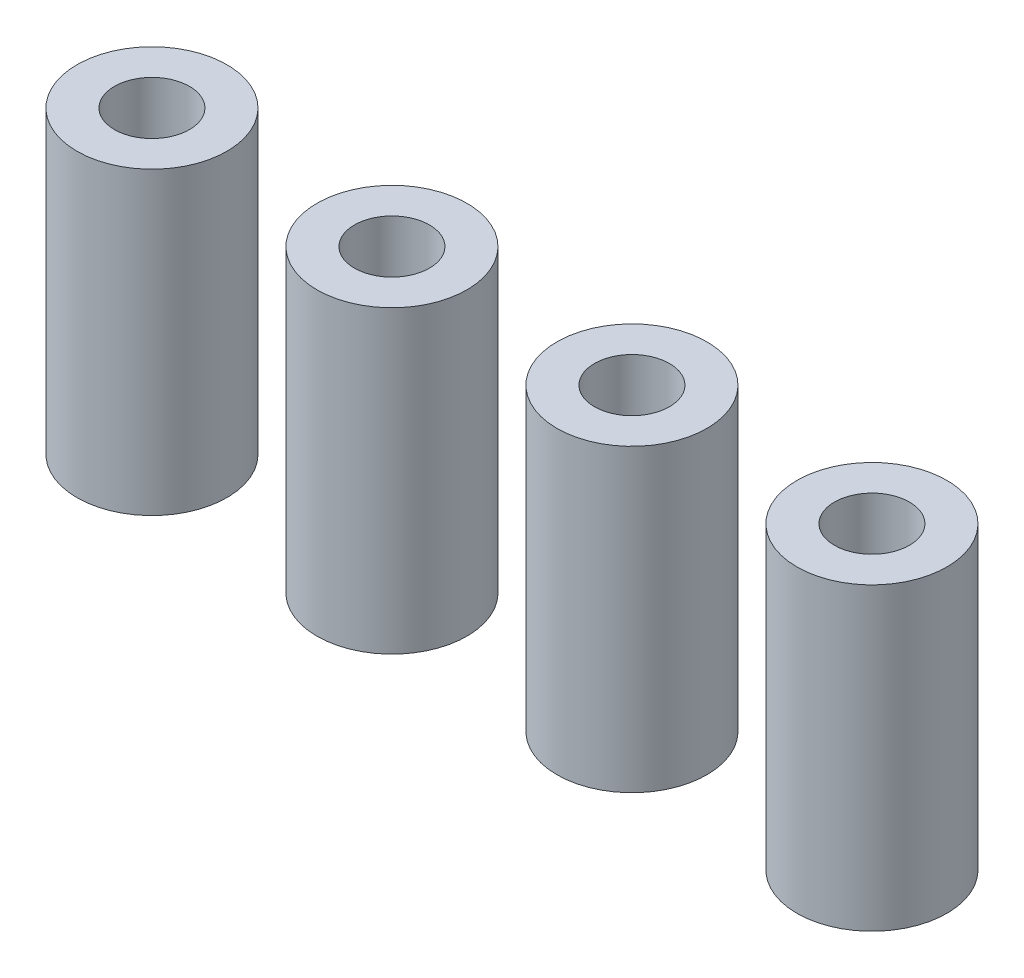
from build123d import *

# Parameters (mm, degrees)
SKETCH1_R             = 2.5
SKETCH1_R_2           = 1.25
BOSS_EXTRUDE1_DEPTH   = 10
BOSS_EXTRUDE1_2_DEPTH = 10
BOSS_EXTRUDE1_3_DEPTH = 10
BOSS_EXTRUDE1_4_DEPTH = 10


with BuildPart() as part:
    # Sketch1 → Boss-Extrude1 (new body)
    with BuildSketch(Plane(origin=(0, 0, 0), x_dir=(1, 0, 0), z_dir=(0, 1, 0))):
        with Locations(Location((0, 0, 0), (0, 0, 270))):
            Circle(SKETCH1_R)
        with Locations(Location((0, 0, 0), (0, 0, 270))):
            Circle(SKETCH1_R_2, mode=Mode.SUBTRACT)
    extrude(amount=BOSS_EXTRUDE1_DEPTH)


with BuildPart() as body_2:
    # Sketch1 → Boss-Extrude1 2 (new body)
    with BuildSketch(Plane(origin=(0, 0, 0), x_dir=(1, 0, 0), z_dir=(0, 1, 0))):
        with Locations(Location((8, 0, 0), (0, 0, 270))):
            Circle(SKETCH1_R)
        with Locations(Location((8, 0, 0), (0, 0, 270))):
            Circle(SKETCH1_R_2, mode=Mode.SUBTRACT)
    extrude(amount=BOSS_EXTRUDE1_2_DEPTH)


with BuildPart() as body_3:
    # Sketch1 → Boss-Extrude1 3 (new body)
    with BuildSketch(Plane(origin=(0, 0, 0), x_dir=(1, 0, 0), z_dir=(0, 1, 0))):
        with Locations(Location((16, 0, 0), (0, 0, 270))):
            Circle(SKETCH1_R)
        with Locations(Location((16, 0, 0), (0, 0, 270))):
            Circle(SKETCH1_R_2, mode=Mode.SUBTRACT)
    extrude(amount=BOSS_EXTRUDE1_3_DEPTH)


with BuildPart() as body_4:
    # Sketch1 → Boss-Extrude1 4 (new body)
    with BuildSketch(Plane(origin=(0, 0, 0), x_dir=(1, 0, 0), z_dir=(0, 1, 0))):
        with Locations(Location((24, 0, 0), (0, 0, 270))):
            Circle(SKETCH1_R)
        with Locations(Location((24, 0, 0), (0, 0, 270))):
            Circle(SKETCH1_R_2, mode=Mode.SUBTRACT)
    extrude(amount=BOSS_EXTRUDE1_4_DEPTH)


solid = Compound([part.part, body_2.part, body_3.part, body_4.part])
